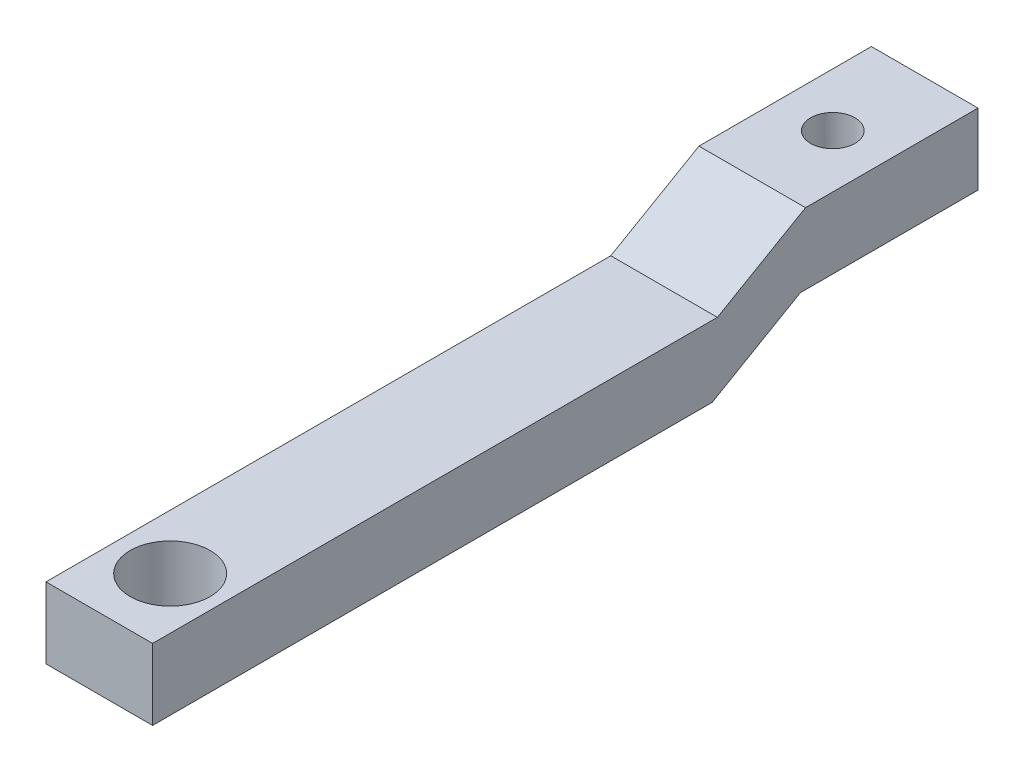
from build123d import *

# Parameters (mm, degrees)
BOSS_EXTRUDE1_DEPTH = 12
CUT_EXTRUDE1_DEPTH  = 13.73


with BuildPart() as part:
    # Sketch1 → Boss-Extrude1 (new body)
    with BuildSketch(Plane(origin=(0, 0, 0), x_dir=(0, 0, -1), z_dir=(1, 0, 0))):
        Polygon((62.995348873, -5.73), (72.92, 0), (92.92, 0), (92.92, 3.314764861), (92.92, 8), (73.504568374, 8), (63.579917247, 2.27), (0, 2.27), (0, 0), (0, -5.73), (26.973026027, -5.73), align=None)
    extrude(amount=-BOSS_EXTRUDE1_DEPTH)

    # Sketch2 → Cut-Extrude1 (cut)
    with BuildSketch(Plane(origin=(0, 8, 0), x_dir=(1, 0, 0), z_dir=(0, 1, 0))):
        with BuildLine():
            ThreePointArc((-5.833418362, 12.299990394), (-10.32411062, 7.790701865), (-5.814822091, 3.300009606))
            Line((-5.814822091, 3.300009606), (-5.833418362, 12.299990394))
        make_face()
        with BuildLine():
            Line((-5.833418362, 12.299990394), (-5.814822091, 3.300009606))
            ThreePointArc((-5.814822091, 3.300009606), (-2.63885402, 4.621308572), (-1.324120226, 7.8))
            ThreePointArc((-1.324120226, 7.8), (-2.645428798, 10.985266206), (-5.833418362, 12.299990394))
        make_face()
        with BuildLine():
            ThreePointArc((-5.983738594, 85.0500168), (-8.478567627, 82.544856506), (-5.973407332, 80.050027474))
            Line((-5.973407332, 80.050027474), (-5.983738594, 85.0500168))
        make_face()
        with BuildLine():
            Line((-5.983738594, 85.0500168), (-5.973407332, 80.050027474))
            ThreePointArc((-5.973407332, 80.050027474), (-4.208980626, 80.784082455), (-3.478572963, 82.550022137))
            ThreePointArc((-3.478572963, 82.550022137), (-4.212633281, 84.319614474), (-5.983738594, 85.0500168))
        make_face()
    extrude(amount=-CUT_EXTRUDE1_DEPTH, mode=Mode.SUBTRACT)


solid = part.part
